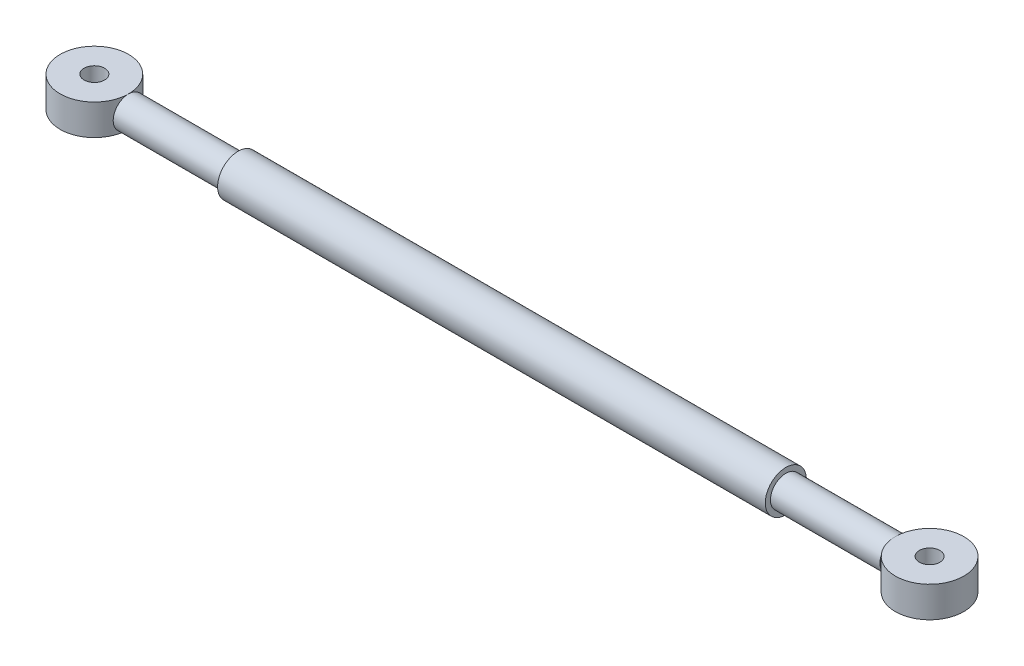
from build123d import *

# Parameters (mm, degrees)
SKETCH1_R             = 3
BOSS_EXTRUDE1_DEPTH   = 40
SKETCH2_R             = 2.25
BOSS_EXTRUDE2_DEPTH   = 16
BOSS_EXTRUDE4_START   = 16
SKETCH4_R             = 2.25
BOSS_EXTRUDE4_DEPTH   = 16
SKETCH3_R             = 5
SKETCH3_R_2           = 1.5
BOSS_EXTRUDE3_DEPTH   = 2.25
BOSS_EXTRUDE3_2_DEPTH = 2.25


with BuildPart() as part:
    # Sketch1 → Boss-Extrude1 (new, symmetric)
    with BuildSketch(Plane(origin=(0, 0, 0), x_dir=(0, 0, -1), z_dir=(1, 0, 0))):
        Circle(SKETCH1_R)
    extrude(amount=BOSS_EXTRUDE1_DEPTH, both=True)

    # Sketch2 → Boss-Extrude2 (add)
    with BuildSketch(Plane(origin=(40, 0, 0), x_dir=(0, 0, -1), z_dir=(1, 0, 0))):
        Circle(SKETCH2_R)
    extrude(amount=BOSS_EXTRUDE2_DEPTH)

    # Sketch4 → Boss-Extrude4 (add)
    with BuildSketch(Plane.ZY.offset(40).offset(BOSS_EXTRUDE4_START)):
        with Locations(Location((0, 0, 0), (0, 0, 180))):
            Circle(SKETCH4_R)
    extrude(amount=-BOSS_EXTRUDE4_DEPTH)


with BuildPart() as body_2:
    # Sketch3 → Boss-Extrude3 (new, symmetric)
    with BuildSketch(Plane(origin=(0, 0, 0), x_dir=(1, 0, 0), z_dir=(0, 1, 0))):
        with Locations(Location((61, 0, 0), (0, 0, 270))):
            Circle(SKETCH3_R)
        with Locations(Location((61, 0, 0), (0, 0, 270))):
            Circle(SKETCH3_R_2, mode=Mode.SUBTRACT)
    extrude(amount=BOSS_EXTRUDE3_DEPTH, both=True)


with BuildPart() as body_3:
    # Sketch3 → Boss-Extrude3 2 (new, symmetric)
    with BuildSketch(Plane(origin=(0, 0, 0), x_dir=(1, 0, 0), z_dir=(0, 1, 0))):
        with Locations(Location((-61, 0, 0), (0, 0, 270))):
            Circle(SKETCH3_R)
        with Locations(Location((-61, 0, 0), (0, 0, 270))):
            Circle(SKETCH3_R_2, mode=Mode.SUBTRACT)
    extrude(amount=BOSS_EXTRUDE3_2_DEPTH, both=True)


solid = Compound([part.part, body_2.part, body_3.part])
